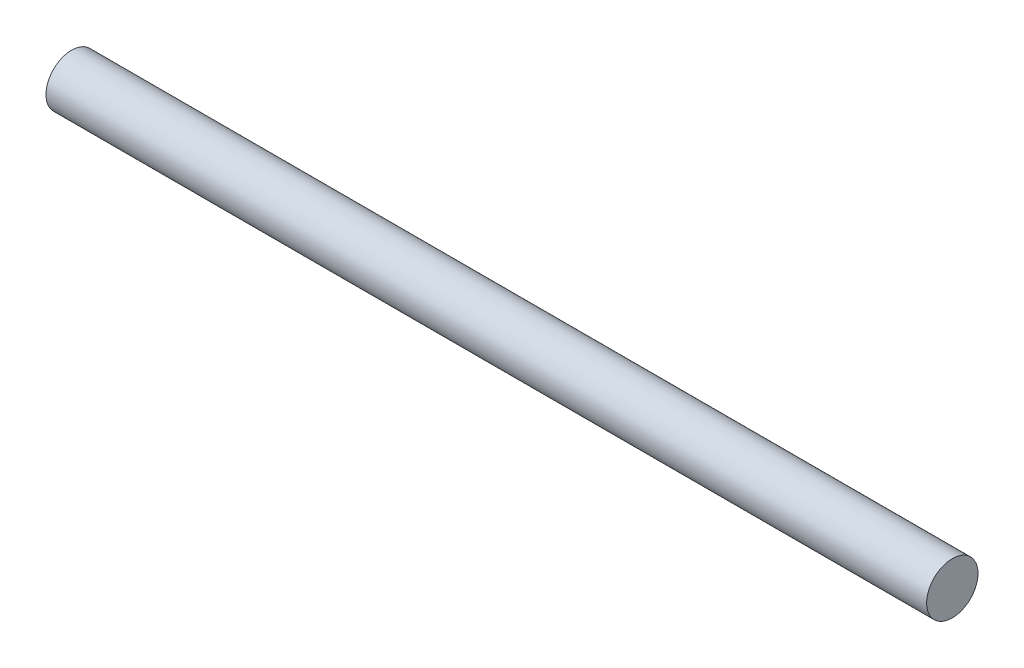
from build123d import *

# Parameters (mm, degrees)
SKETCH1_R      = 1.4
EXTRUDE1_DEPTH = 48


with BuildPart() as part:
    # Sketch1 → Extrude1 (new body)
    with BuildSketch(Plane(origin=(0, 0, 0), x_dir=(0, 0, -1), z_dir=(1, 0, 0))):
        Circle(SKETCH1_R)
    extrude(amount=EXTRUDE1_DEPTH)


solid = part.part
